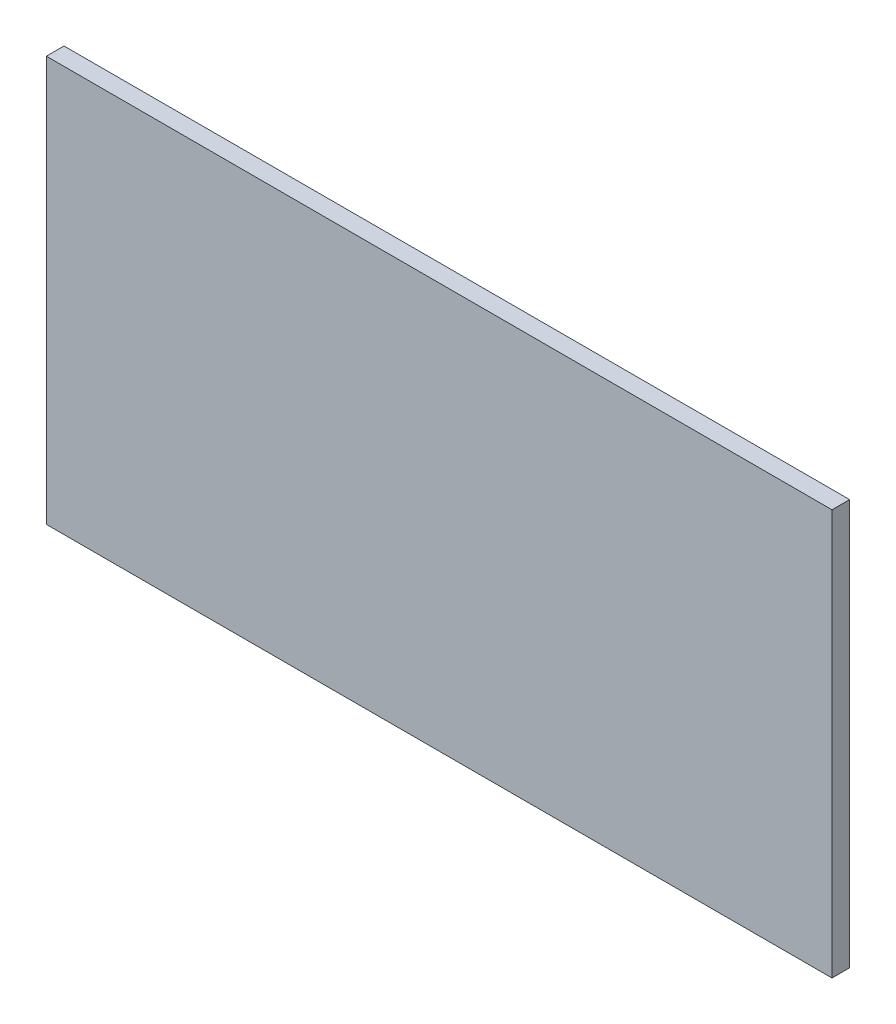
from build123d import *

# Parameters (mm, degrees)
SKETCH_1_W      = 713
SKETCH_1_H      = 368
EXTRUDE_1_DEPTH = 16


with BuildPart() as part:
    # 草图1 → 凸台-拉伸1 (new body)
    with BuildSketch(Plane.XY):
        Rectangle(SKETCH_1_W, SKETCH_1_H)
    extrude(amount=EXTRUDE_1_DEPTH)


solid = part.part
